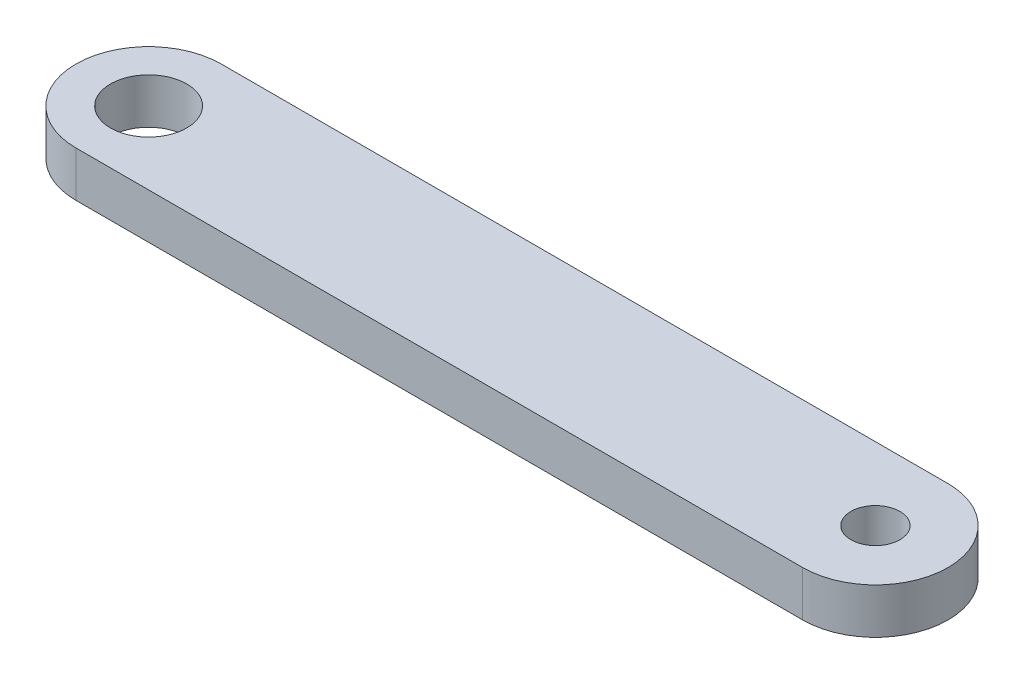
from build123d import *

# Parameters (mm, degrees)
SKETCH1_R           = 2.667
SKETCH1_R_2         = 1.7145
BOSS_EXTRUDE1_DEPTH = 1.5875


with BuildPart() as part:
    # Sketch1 → Boss-Extrude1 (new, symmetric)
    with BuildSketch(Plane(origin=(0, 0, 0), x_dir=(1, 0, 0), z_dir=(0, 1, 0))):
        with BuildLine():
            Line((0, 5.08), (50.8, 5.08))
            ThreePointArc((50.8, 5.08), (55.88, 0), (50.8, -5.08))
            Line((50.8, -5.08), (0, -5.08))
            ThreePointArc((0, -5.08), (-5.08, 0), (0, 5.08))
        make_face()
        with Locations(Location((0, 0, 0), (0, 0, 270))):
            Circle(SKETCH1_R, mode=Mode.SUBTRACT)
        with Locations(Location((50.8, 0, 0), (0, 0, 270))):
            Circle(SKETCH1_R_2, mode=Mode.SUBTRACT)
    extrude(amount=BOSS_EXTRUDE1_DEPTH, both=True)


solid = part.part
